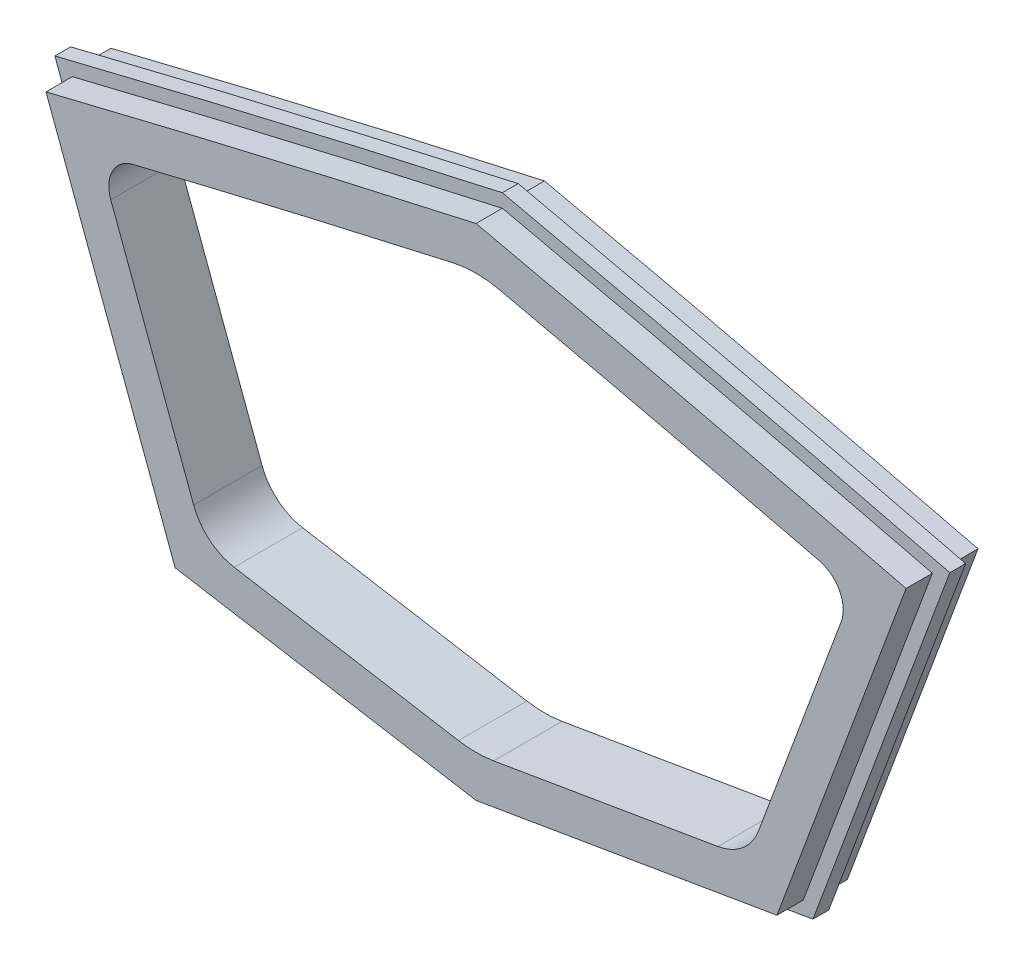
from build123d import *

# Parameters (mm, degrees)
BOSS_EXTRUDE1_DEPTH = 3
FILLET1_R           = 20
FILLET2_R           = 10
FILLET3_R           = 6
BOSS_EXTRUDE2_START = 5
BOSS_EXTRUDE2_DEPTH = 5
BOSS_EXTRUDE3_DEPTH = 5


with BuildPart() as part:
    # Sketch1 → Boss-Extrude1 (new body)
    with BuildSketch(Plane.XY):
        with BuildLine():
            Line((58.995636199, -70), (85.000010905, 5.7991e-05))
            add(Edge.make_bspline(
                [(85.000010905, 5.7991e-05), (56.750474686, 7.0174992), (28.420775895, 13.71150164), (7.678e-06, 19.999882532)],
                knots=[0, 0, 0, 0, 1, 1, 1, 1], degree=3))
            add(Edge.make_bspline(
                [(7.678e-06, 19.999882532), (-28.420729921, 13.711538103), (-56.750527687, 7.017544413), (-85.000042152, 0.000142104)],
                knots=[0, 0, 0, 0, 1, 1, 1, 1], degree=3))
            Line((-85.000042152, 0.000142104), (-58.995636199, -70))
            Line((-58.995636199, -70), (0, -80))
            Line((0, -80), (58.995636199, -70))
        make_face()
        with BuildLine():
            Line((51.632125707, -61.105504126), (71.72329576, -7.02294745))
            add(Edge.make_bspline(
                [(71.72329576, -7.02294745), (65.760246295, -5.560581522), (53.826176048, -2.665485282), (35.906371118, 1.582198174), (17.96537234, 5.730748209), (5.991311045, 8.427016674), (2.578e-06, 9.757206823)],
                knots=[0.12850852, 0.12850852, 0.12850852, 0.12850852, 0.340025725, 0.551542931, 0.763060137, 0.974577343, 0.974577343, 0.974577343, 0.974577343], degree=3))
            add(Edge.make_bspline(
                [(2.578e-06, 9.757206823), (-5.991303797, 8.427023399), (-17.965355756, 5.730769647), (-35.906372035, 1.582235194), (-53.826198007, -2.665432907), (-65.760270504, -5.560515659), (-71.723322613, -7.022875166)],
                knots=[0.025422687, 0.025422687, 0.025422687, 0.025422687, 0.236939832, 0.448456977, 0.659974121, 0.871491266, 0.871491266, 0.871491266, 0.871491266], degree=3))
            Line((-71.723322613, -7.022875166), (-51.632125707, -61.105504126))
            Line((-51.632125707, -61.105504126), (0, -69.857359184))
            Line((0, -69.857359184), (51.632125707, -61.105504126))
        make_face(mode=Mode.SUBTRACT)
    extrude(amount=BOSS_EXTRUDE1_DEPTH)

    # Fillet1
    fillet1_edges = [part.edges().sort_by_distance(p)[0] for p in [
        (0, -69.857359184, 1.5),
        (2.578e-06, 9.757206823, 1.5),
    ]]
    fillet(fillet1_edges, radius=FILLET1_R)

    # Fillet2
    fillet2_edges = [part.edges().sort_by_distance(p)[0] for p in [
        (51.632125707, -61.105504126, 1.5),
        (-51.632125707, -61.105504126, 1.5),
    ]]
    fillet(fillet2_edges, radius=FILLET2_R)

    # Fillet3
    fillet3_edges = [part.edges().sort_by_distance(p)[0] for p in [
        (71.72329576, -7.02294745, 1.5),
        (-71.723322613, -7.022875166, 1.5),
    ]]
    fillet(fillet3_edges, radius=FILLET3_R)

    # Sketch2 → Boss-Extrude2 (add)
    with BuildSketch(Plane.XY.offset(3).offset(BOSS_EXTRUDE2_START)):
        with BuildLine():
            Line((-81.681959277, -1.75265922), (-57.154758576, -67.776376032))
            Line((-57.154758576, -67.776376032), (0, -77.464339796))
            Line((0, -77.464339796), (57.154758576, -67.776376032))
            Line((57.154758576, -67.776376032), (81.681929126, -1.752740382))
            add(Edge.make_bspline(
                [(81.681929126, -1.752740382), (54.532239341, 4.970251393), (27.308171531, 11.391977282), (6.404e-06, 17.439367697)],
                knots=[0, 0, 0, 0, 1, 1, 1, 1], degree=3))
            add(Edge.make_bspline(
                [(6.404e-06, 17.439367697), (-27.308135136, 11.392011032), (-54.532288876, 4.970295529), (-81.681959277, -1.75265922)],
                knots=[0, 0, 0, 0, 1, 1, 1, 1], degree=3))
        make_face()
        with BuildLine():
            Line((-69.376008475, -13.341509152), (-53.642677645, -55.693385824))
            ThreePointArc((-53.642677645, -55.693385824), (-50.645602116, -59.913867336), (-45.939817671, -62.070373463))
            Line((-45.939817671, -62.070373463), (-3.342404912, -69.290807973))
            ThreePointArc((-3.342404912, -69.290807973), (0, -69.572077553), (3.342404912, -69.290807973))
            Line((3.342404912, -69.290807973), (45.939817671, -62.070373463))
            ThreePointArc((45.939817671, -62.070373463), (50.645602116, -59.913867336), (53.642677645, -55.693385824))
            Line((53.642677645, -55.693385824), (69.375984259, -13.341574337))
            ThreePointArc((69.375984259, -13.341574337), (69.05053211, -8.437764256), (65.169862303, -5.422192294))
            add(Edge.make_bspline(
                [(65.169862303, -5.422192294), (61.388993913, -4.502380085), (51.638475989, -2.146916169), (35.906371118, 1.582198174), (19.417348722, 5.39500343), (8.898318707, 7.771361324), (4.363182833, 8.785163741)],
                knots=[0.205976361, 0.205976361, 0.205976361, 0.205976361, 0.340025725, 0.551542931, 0.763060137, 0.923222679, 0.923222679, 0.923222679, 0.923222679], degree=3))
            ThreePointArc((4.363182833, 8.785163741), (2.348e-06, 9.266901295), (-4.363178618, 8.785168098))
            add(Edge.make_bspline(
                [(-4.363178618, 8.785168098), (-8.898311373, 7.771371135), (-19.41733449, 5.395025913), (-35.906372035, 1.582235194), (-51.638493171, -2.146865145), (-61.389012491, -4.502317987), (-65.169880027, -5.422125529)],
                knots=[0.076777369, 0.076777369, 0.076777369, 0.076777369, 0.236939832, 0.448456977, 0.659974121, 0.794023369, 0.794023369, 0.794023369, 0.794023369], degree=3))
            ThreePointArc((-65.169880027, -5.422125529), (-69.050554759, -8.437696121), (-69.376008475, -13.341509152))
        make_face(mode=Mode.SUBTRACT)
    extrude(amount=-BOSS_EXTRUDE2_DEPTH)

    # Sketch3 → Boss-Extrude3 (add)
    with BuildSketch(Plane(origin=(0, 0, 0), x_dir=(-1, 0, 0), z_dir=(0, 0, -1))):
        with BuildLine():
            Line((57.522934276, -68.221100795), (82.345641792, -1.401949233))
            add(Edge.make_bspline(
                [(82.345641792, -1.401949233), (54.976968444, 5.379009049), (27.531586141, 11.851868369), (0.000183244, 17.939432259)],
                knots=[-0.01124673, -0.01124673, -0.01124673, -0.01124673, 1.075105268, 1.075105268, 1.075105268, 1.075105268], degree=3))
            add(Edge.make_bspline(
                [(0.000183244, 17.939432259), (-27.531342023, 11.851872874), (-54.976750263, 5.379036047), (-82.345641148, -1.401950967)],
                knots=[-0.075105482, -0.075105482, -0.075105482, -0.075105482, 1.011252332, 1.011252332, 1.011252332, 1.011252332], degree=3))
            Line((-82.345641148, -1.401950967), (-57.522934276, -68.221100795))
            Line((-57.522934276, -68.221100795), (0, -77.971471837))
            Line((0, -77.971471837), (57.522934276, -68.221100795))
        make_face()
        with BuildLine():
            Line((-53.642677645, -55.693385824), (-69.375984259, -13.341574337))
            ThreePointArc((-69.375984259, -13.341574337), (-69.05053211, -8.437764256), (-65.169862303, -5.422192294))
            add(Edge.make_bspline(
                [(-65.169862303, -5.422192294), (-61.388993913, -4.502380085), (-51.638475989, -2.146916169), (-35.906371118, 1.582198174), (-19.417348722, 5.39500343), (-8.898318707, 7.771361324), (-4.363182833, 8.785163741)],
                knots=[0.205976361, 0.205976361, 0.205976361, 0.205976361, 0.340025725, 0.551542931, 0.763060137, 0.923222679, 0.923222679, 0.923222679, 0.923222679], degree=3))
            ThreePointArc((-4.363182833, 8.785163741), (-2.348e-06, 9.266901295), (4.363178618, 8.785168098))
            add(Edge.make_bspline(
                [(4.363178618, 8.785168098), (8.898311373, 7.771371135), (19.41733449, 5.395025913), (35.906372035, 1.582235194), (51.638493171, -2.146865145), (61.389012491, -4.502317987), (65.169880027, -5.422125529)],
                knots=[0.076777369, 0.076777369, 0.076777369, 0.076777369, 0.236939832, 0.448456977, 0.659974121, 0.794023369, 0.794023369, 0.794023369, 0.794023369], degree=3))
            ThreePointArc((65.169880027, -5.422125529), (69.050554759, -8.437696121), (69.376008475, -13.341509152))
            Line((69.376008475, -13.341509152), (53.642677645, -55.693385824))
            ThreePointArc((53.642677645, -55.693385824), (50.645602116, -59.913867336), (45.939817671, -62.070373463))
            Line((45.939817671, -62.070373463), (3.342404912, -69.290807973))
            ThreePointArc((3.342404912, -69.290807973), (0, -69.572077553), (-3.342404912, -69.290807973))
            Line((-3.342404912, -69.290807973), (-45.939817671, -62.070373463))
            ThreePointArc((-45.939817671, -62.070373463), (-50.645602116, -59.913867336), (-53.642677645, -55.693385824))
        make_face(mode=Mode.SUBTRACT)
    extrude(amount=BOSS_EXTRUDE3_DEPTH)


solid = part.part
